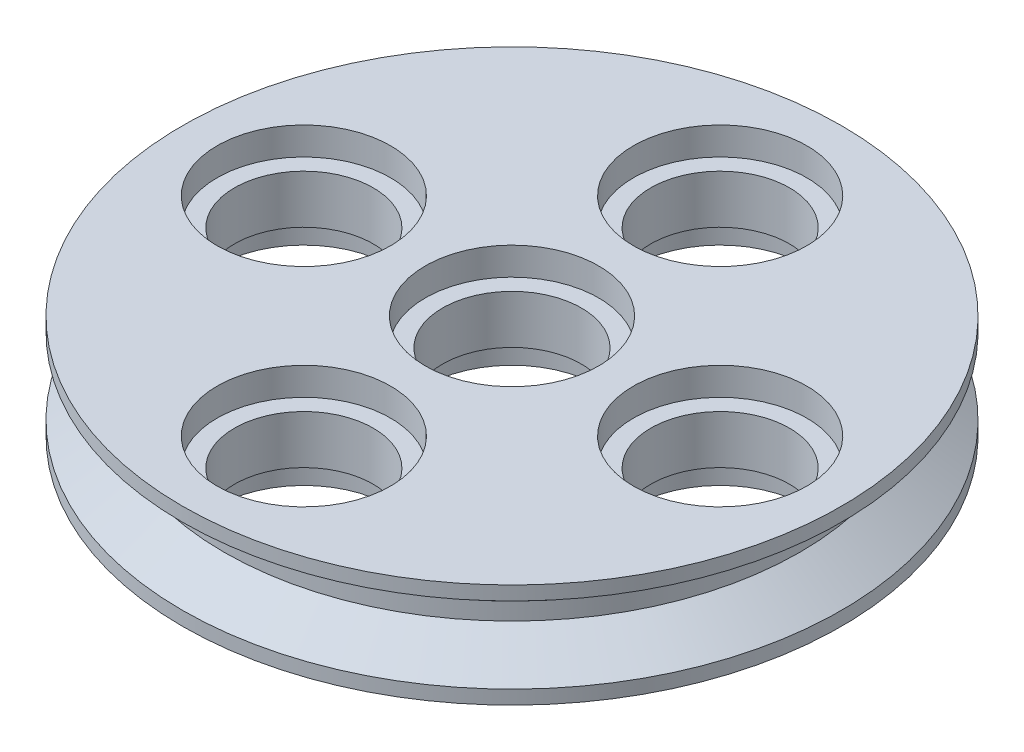
from build123d import *

# Parameters (mm, degrees)
HOLE1_D           = 4
HOLE1_DEPTH       = 1.5
HOLE1_CBORE_D     = 5
HOLE1_CBORE_DEPTH = 0.8
HOLE1_TIP         = 1.201721238


with BuildPart() as part:
    # Sketch1 → Revolve1 (revolve)
    with BuildSketch(Plane.XY, mode=Mode.PRIVATE) as revolve1_sk:
        Polygon((0, 0), (0, 1.5), (-9.5, 1.5), (-9.5, 1.1), (-8.300666852, 0.25), (-8.300666852, 0), align=None)
    revolve(revolve1_sk.sketch.rotate(Axis((0, 0, 0), (0, 1, 0)), 270), axis=Axis((0, 0, 0), (0, 1, 0)))

    # Hole1
    with Locations(Plane(origin=(0, 1.5, 0), x_dir=(1, 0, 0), z_dir=(0, 1, 0))):
        with Locations((0, 0), (0, 6), (-6, 0), (0, -6), (6, 0)):
            CounterBoreHole(HOLE1_D / 2, HOLE1_CBORE_D / 2, HOLE1_CBORE_DEPTH, depth=HOLE1_DEPTH)
            with Locations((0, 0, -(HOLE1_DEPTH + HOLE1_TIP / 2))):  # 118° drill point
                Cone(0, HOLE1_D / 2, HOLE1_TIP, mode=Mode.SUBTRACT)

    # Mirror1: part across plane


with BuildPart() as part_1:
    add(part.part)
    add(part.part.mirror(Plane.ZX))


solid = part_1.part
